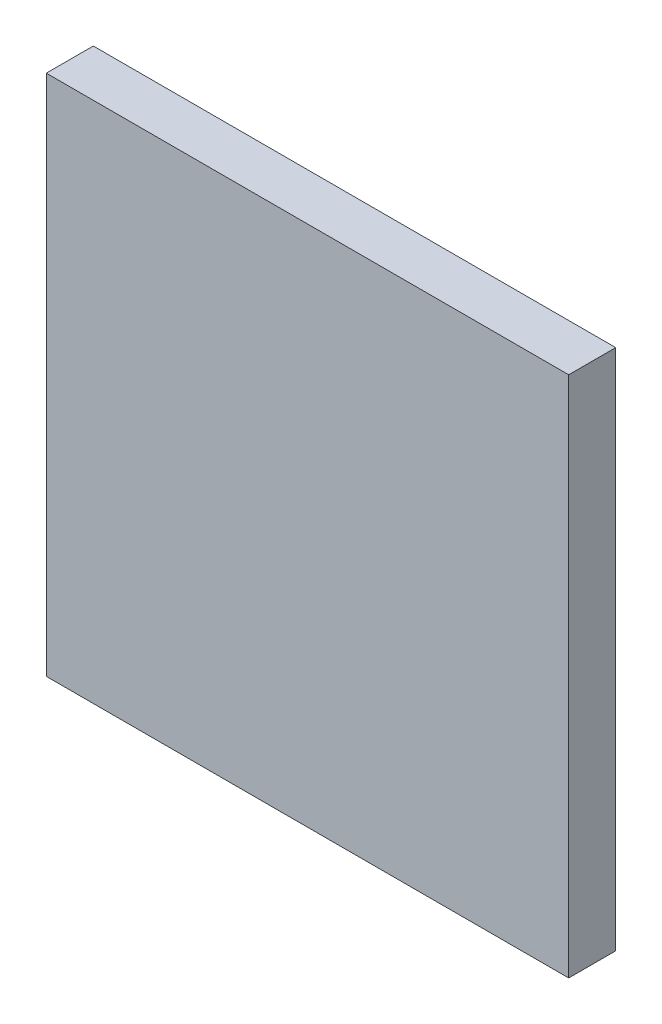
from build123d import *

# Parameters (mm, degrees)
SKETCH_1_W      = 10
SKETCH_1_H      = 10
EXTRUDE_1_DEPTH = 0.9


with BuildPart() as part:
    # 草图1 → 凸台-拉伸1 (new body)
    with BuildSketch(Plane.XY):
        Rectangle(SKETCH_1_W, SKETCH_1_H)
    extrude(amount=EXTRUDE_1_DEPTH)


solid = part.part
